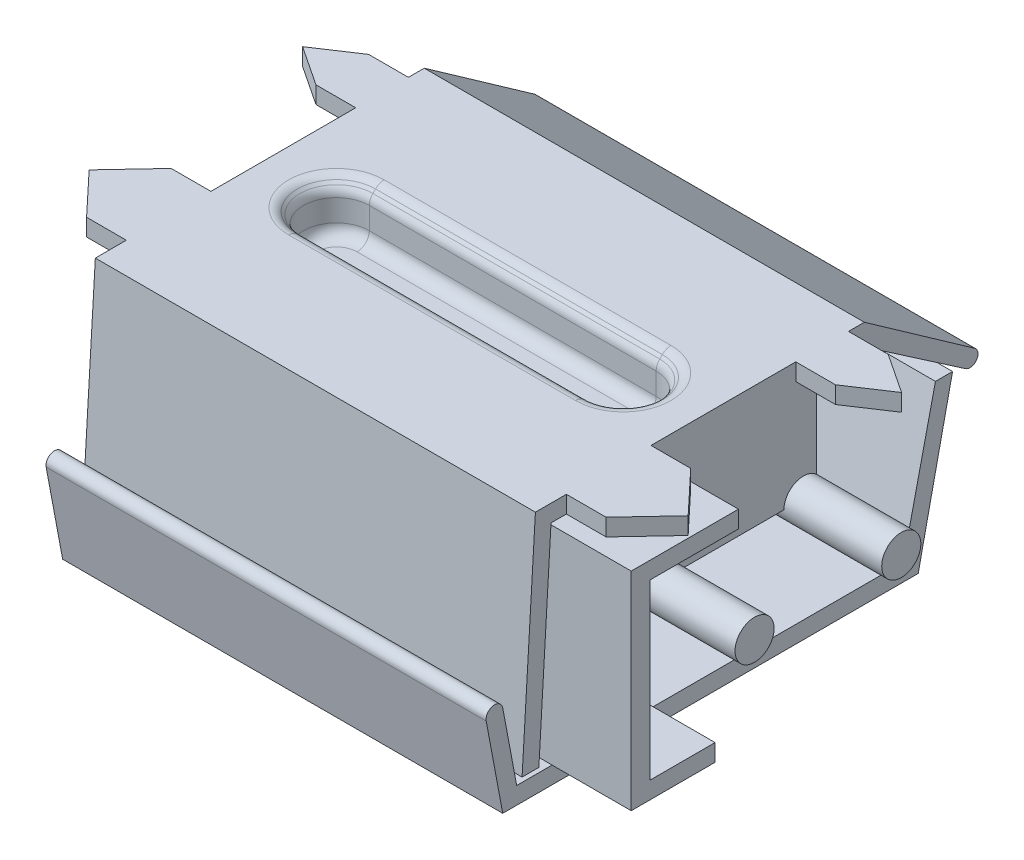
from build123d import *

# Parameters (mm, degrees)
RESSALTO_EXTRUS_O1_DEPTH      = 9
RESSALTO_EXTRUS_O1_2_DEPTH    = 9
CORTE_EXTRUS_O1_DEPTH         = 1
CHANFRO1_SIZE                 = 0.2
FILETE1_R                     = 0.25
FILETE2_R                     = 0.25
FILETE3_R                     = 0.25
RESSALTO_EXTRUS_O2_DEPTH      = 3
RESSALTO_EXTRUS_O2_DEPTH_BACK = 12
ESBO_O3_R                     = 0.4
ESBO_O4_W                     = 1.462776185
ESBO_O4_H                     = 17.561147647
CORTE_EXTRUS_O3_DEPTH         = 12
RESSALTO_EXTRUS_O3_DEPTH      = 4
RESSALTO_EXTRUS_O3_DEPTH_BACK = 12
ESBO_O5_W                     = 1.730119391
ESBO_O5_H                     = 0.35
ESBO_O5_W_2                   = 1.077736426
CORTE_EXTRUS_O6_DEPTH         = 0.36
CORTE_EXTRUS_O8_DEPTH         = 2.36
CORTE_EXTRUS_O9_DEPTH         = 3
CORTE_EXTRUS_O10_DEPTH        = 0.36
CORTE_EXTRUS_O11_DEPTH        = 0.36


with BuildPart() as part:
    # Esboço1 → Ressalto-extrusão1 (new body)
    with BuildSketch(Plane(origin=(0, 0, 0), x_dir=(0, 0, -1), z_dir=(1, 0, 0))):
        with BuildLine():
            ThreePointArc((5, 0.912371134), (5.039602728, 0.68438786), (4.811619455, 0.644785132))
            Line((4.811619455, 0.644785132), (2.61869959, 2.15))
            Line((2.61869959, 2.15), (1.765244755, 2.15))
            Line((1.765244755, 2.15), (1.765244755, 0))
            Line((1.765244755, 0), (-1.765244755, 0))
            Line((-1.765244755, 0), (-1.765244755, 2.15))
            Line((-1.765244755, 2.15), (-3.6626751, 2.15))
            Line((-3.6626751, 2.15), (-3.911509847, -2.056109913))
            Line((-3.911509847, -2.056109913), (-4.254719223, -2.056109913))
            Line((-4.254719223, -2.056109913), (-3.981958763, 2.5))
            Line((-3.981958763, 2.5), (2.744845361, 2.5))
            Line((2.744845361, 2.5), (5, 0.912371134))
        make_face()
    extrude(amount=RESSALTO_EXTRUS_O1_DEPTH)

    # Esboço2 → Corte-extrusão1 (cut)
    with BuildSketch(Plane(origin=(0, 2.5, 0), x_dir=(1, 0, 0), z_dir=(0, 1, 0))):
        with BuildLine():
            Line((1.567113196, 0.054268876), (7.432886804, 0.054268876))
            ThreePointArc((7.432886804, 0.054268876), (8.10571238, -0.618556701), (7.432886804, -1.291382278))
            Line((7.432886804, -1.291382278), (1.567113196, -1.291382278))
            ThreePointArc((1.567113196, -1.291382278), (0.89428762, -0.618556701), (1.567113196, 0.054268876))
        make_face()
    extrude(amount=-CORTE_EXTRUS_O1_DEPTH, mode=Mode.SUBTRACT)

    # Chanfro1
    chanfro1_edges = [part.edges().sort_by_distance(p)[0] for p in [
        (0.89428762, 2.5, 0.618556701),
        (4.5, 2.5, 1.291382278),
        (8.10571238, 2.5, 0.618556701),
        (4.5, 2.5, -0.054268876),
    ]]
    chamfer(chanfro1_edges, length=CHANFRO1_SIZE)

    # Filete1
    filete1_edges = [part.edges().sort_by_distance(p)[0] for p in [
        (4.5, 2.5, 1.491382278),
        (8.30571238, 2.5, 0.618556701),
        (0.69428762, 2.5, 0.618556701),
        (4.5, 2.5, -0.254268876),
    ]]
    fillet(filete1_edges, radius=FILETE1_R)

    # Filete2
    filete2_edges = [part.edges().sort_by_distance(p)[0] for p in [
        (4.5, 2.3, -0.054268876),
        (0.89428762, 2.3, 0.618556701),
        (8.10571238, 2.3, 0.618556701),
        (4.5, 2.3, 1.291382278),
    ]]
    fillet(filete2_edges, radius=FILETE2_R)

    # Filete3
    filete3_edges = [part.edges().sort_by_distance(p)[0] for p in [
        (0.89428762, 1.5, 0.618556701),
        (4.5, 1.5, -0.054268876),
        (8.10571238, 1.5, 0.618556701),
        (4.5, 1.5, 1.291382278),
    ]]
    fillet(filete3_edges, radius=FILETE3_R)

    # Esboço3 → Ressalto-extrusão2 (add, two sides: drawn at the far end of the back side and taken through both)
    with BuildSketch(Plane(origin=(9, 0, 0), x_dir=(0, 0, -1), z_dir=(1, 0, 0)).offset(-RESSALTO_EXTRUS_O2_DEPTH_BACK)):
        with Locations((1.5, 0)):
            Circle(ESBO_O3_R)
        with Locations((-1.5, 0)):
            Circle(ESBO_O3_R)
    extrude(amount=RESSALTO_EXTRUS_O2_DEPTH + RESSALTO_EXTRUS_O2_DEPTH_BACK)

    # Esboço4 → Corte-extrusão3 (cut)
    with BuildSketch(Plane(origin=(0, 2.963575633, -2.086357246), x_dir=(1, 0, 0), z_dir=(0, 0.8176923764210481, -0.5756554330004183))):
        with Locations((11.731388093, -2.530326619)):
            Rectangle(ESBO_O4_W, ESBO_O4_H)
        with Locations((-2.731388093, -2.530326619)):
            Rectangle(ESBO_O4_W, ESBO_O4_H)
    extrude(amount=-CORTE_EXTRUS_O3_DEPTH, mode=Mode.SUBTRACT)

    # Esboço5 → Ressalto-extrusão3 (add, two sides: drawn at the far end of the back side and taken through both)
    with BuildSketch(Plane(origin=(9, 0, 0), x_dir=(0, 0, -1), z_dir=(1, 0, 0)).offset(-RESSALTO_EXTRUS_O3_DEPTH_BACK)):
        Polygon((-3.6626751, 2.116911528), (-3.6626751, -2.127847944), (-1.947482914, -2.127847944), (-1.947482914, -1.777847944), (-3.275815381, -1.777847944), (-3.275815381, 1.766911528), (-1.469749308, 1.766911528), (-1.469749308, 2.116911528), align=None)
        with Locations((-2.483476717, 2.325)):
            Rectangle(ESBO_O5_W, ESBO_O5_H)
        with Locations((1.881616355, 2.325)):
            Rectangle(ESBO_O5_W_2, ESBO_O5_H)
    extrude(amount=RESSALTO_EXTRUS_O3_DEPTH + RESSALTO_EXTRUS_O3_DEPTH_BACK)

    # Esboço7 → Corte-extrusão6 (cut)
    with BuildSketch(Plane(origin=(0, 2.5, 0), x_dir=(1, 0, 0), z_dir=(0, 1, 0))):
        Polygon((10.625, -8.423324635), (15.073277982, -8.423324635), (15.073277982, 13.913015356), (10.913616259, 13.913015356), (10.625, 11.310202992), (10.625, -5.82051227), align=None)
        Polygon((-1.625, -5.82051227), (-1.625, 11.310202992), (-1.300663163, 13.913015356), (-6.073277982, 13.913015356), (-6.073277982, -8.423324635), (-1.625, -8.423324635), align=None)
    extrude(amount=-CORTE_EXTRUS_O6_DEPTH, mode=Mode.SUBTRACT)

    # Esboço11 → Corte-extrusão8 (cut)
    with BuildSketch(Plane(origin=(13, 0, 0), x_dir=(0, 0, -1), z_dir=(1, 0, 0))):
        Polygon((-3.6626751, 2.116911528), (-1.469749308, 2.116911528), (-1.469749308, 1.766911528), (-3.275815381, 1.766911528), (-3.275815381, -1.777847944), (-1.947482914, -1.777847944), (-1.947482914, -2.127847944), (-3.6626751, -2.127847944), align=None)
    extrude(amount=-CORTE_EXTRUS_O8_DEPTH, mode=Mode.SUBTRACT)

    # Esboço12 → Corte-extrusão9 (cut)
    with BuildSketch(Plane.ZY.offset(3)):
        Polygon((1.469749308, 2.116911528), (1.469749308, 1.766911528), (3.275815381, 1.766911528), (3.275815381, -1.777847944), (1.947482914, -1.777847944), (1.947482914, -2.127847944), (3.6626751, -2.127847944), (3.6626751, 2.116911528), align=None)
    extrude(amount=-CORTE_EXTRUS_O9_DEPTH, mode=Mode.SUBTRACT)

    # Esboço13 → Corte-extrusão10 (cut)
    with BuildSketch(Plane(origin=(0, 2.5, 0), x_dir=(1, 0, 0), z_dir=(0, 1, 0))):
        Polygon((-1.625, 1.881616355), (-0.8125, 2.420484568), (-0.619357686, 3.416910301), (-2.700274801, 2.918697434), (-3.188623859, 0.39929318), (-0.8125, 0.220139081), (-0.8125, 1.342748142), align=None)
        Polygon((-1.625, -2.483476717), (-0.8125, -1.618417021), (-1.509025148, -0.428262629), (-2.971698772, -0.835398587), (-2.805828567, -2.916006565), (-2.566502248, -4.18187146), (-1.625, -4.378989326), (-0.8125, -3.348536412), align=None)
    extrude(amount=-CORTE_EXTRUS_O10_DEPTH, mode=Mode.SUBTRACT)

    # Esboço14 → Corte-extrusão11 (cut)
    with BuildSketch(Plane(origin=(0, 2.5, 0), x_dir=(1, 0, 0), z_dir=(0, 1, 0))):
        Polygon((10.625, 1.881616355), (9.8125, 2.420484568), (9.8125, 3.383797521), (12.178736947, 2.576774689), (12.29047857, 0.913066082), (10.142556264, 0.180537666), (9.8125, 1.342748142), align=None)
        Polygon((10.625, -2.483476717), (9.8125, -1.618417021), (9.8125, -0.837552676), (12.886433892, -1.39626079), (11.818680607, -3.348536412), (10.527444076, -4.028396796), (9.8125, -3.348536412), align=None)
    extrude(amount=-CORTE_EXTRUS_O11_DEPTH, mode=Mode.SUBTRACT)


with BuildPart() as body_2:
    # Esboço1 → Ressalto-extrus_o1 2 (new body)
    with BuildSketch(Plane(origin=(0, 0, 0), x_dir=(0, 0, -1), z_dir=(1, 0, 0))):
        with BuildLine():
            Line((-4.65, -2.5), (3.847277584, -2.5))
            Line((3.847277584, -2.5), (3.922324932, -2.149484536))
            Line((3.922324932, -2.149484536), (4.549458244, 0.725462093))
            Line((4.549458244, 0.725462093), (4.199458244, 0.725462093))
            Line((4.199458244, 0.725462093), (3.541450501, -2.149484536))
            Line((3.541450501, -2.149484536), (-4.364736204, -2.149484536))
            Line((-4.364736204, -2.149484536), (-4.650020475, -0.633911844))
            ThreePointArc((-4.650020475, -0.633911844), (-4.850815775, -0.496687472), (-4.988104747, -0.697438608))
            Line((-4.988104747, -0.697438608), (-4.65, -2.5))
        make_face()
    extrude(amount=RESSALTO_EXTRUS_O1_2_DEPTH)


solid = Compound([part.part, body_2.part])
